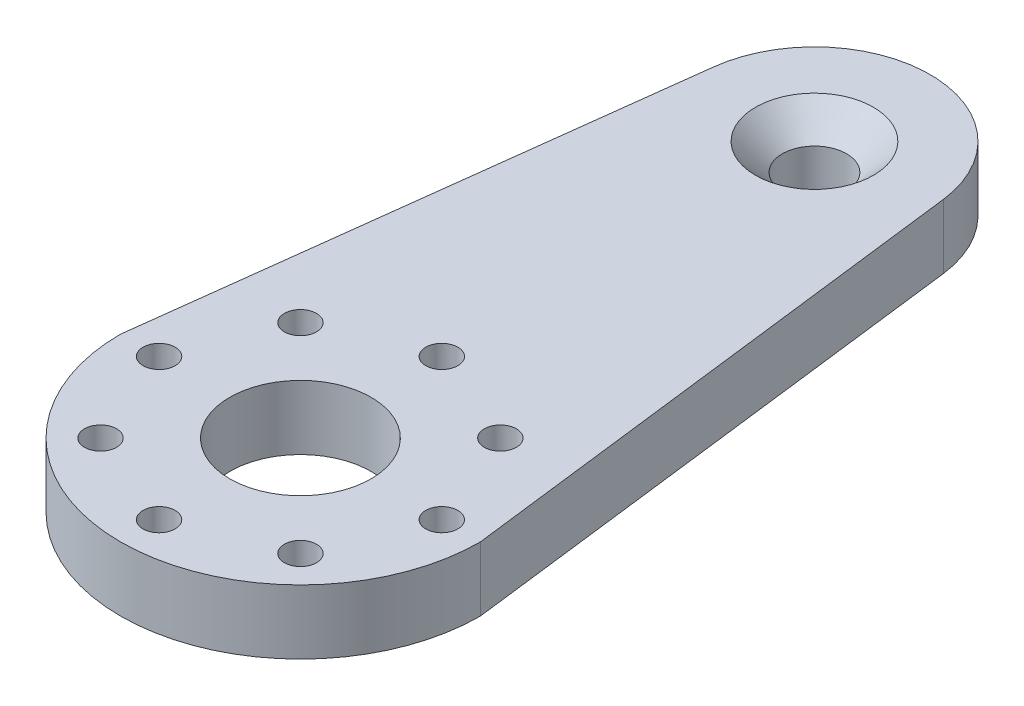
from build123d import *

# Parameters (mm, degrees)
SKETCH1_R                                            = 2.5
SKETCH1_R_2                                          = 5.5
BOSS_EXTRUDE1_DEPTH                                  = 5
SKETCH2_R                                            = 1.25
CUT_EXTRUDE1_DEPTH                                   = 57.00892786
CUT_EXTRUDE2_DEPTH                                   = 57.00892786
CSK_FOR_M4_HEX_SOCKET_COUNTERSUNK_HEAD_S_D           = 4.5
CSK_FOR_M4_HEX_SOCKET_COUNTERSUNK_HEAD_S_CSINK_D     = 9.18
CSK_FOR_M4_HEX_SOCKET_COUNTERSUNK_HEAD_S_CSINK_ANGLE = 90


with BuildPart() as part:
    # Sketch1 → Boss-Extrude1 (new body)
    with BuildSketch(Plane(origin=(0, 0, 0), x_dir=(1, 0, 0), z_dir=(0, 1, 0))):
        with BuildLine():
            Line((-14, 0), (-14, 40))
            ThreePointArc((-14, 40), (0, 54), (14, 40))
            Line((14, 40), (14, 0))
            ThreePointArc((14, 0), (0, -14), (-14, 0))
        make_face()
        with Locations(Location((0, 40, 0), (0, 0, 270))):
            Circle(SKETCH1_R, mode=Mode.SUBTRACT)
        with Locations(Location((0, 0, 0), (0, 0, 270))):
            Circle(SKETCH1_R_2, mode=Mode.SUBTRACT)
    extrude(amount=BOSS_EXTRUDE1_DEPTH)

    # Sketch2 → Cut-Extrude1 (cut, through all)
    with BuildSketch(Plane(origin=(0, 5, 0), x_dir=(1, 0, 0), z_dir=(0, 1, 0))):
        with Locations(Location((0, 11, 0), (0, 0, 270))):
            Circle(SKETCH2_R)
        with Locations(Location((7.778174593, 7.778174593, 0), (0, 0, 270))):
            Circle(SKETCH2_R)
        with Locations(Location((11, 0, 0), (0, 0, 270))):
            Circle(SKETCH2_R)
        with Locations(Location((7.778174593, -7.778174593, 0), (0, 0, 270))):
            Circle(SKETCH2_R)
        with Locations(Location((0, -11, 0), (0, 0, 270))):
            Circle(SKETCH2_R)
        with Locations(Location((-7.778174593, -7.778174593, 0), (0, 0, 270))):
            Circle(SKETCH2_R)
        with Locations(Location((-11, 0, 0), (0, 0, 270))):
            Circle(SKETCH2_R)
        with Locations(Location((-7.778174593, 7.778174593, 0), (0, 0, 270))):
            Circle(SKETCH2_R)
    extrude(amount=-CUT_EXTRUDE1_DEPTH, mode=Mode.SUBTRACT)

    # Sketch3 → Cut-Extrude2 (cut, through all)
    with BuildSketch(Plane(origin=(0, 5, 0), x_dir=(1, 0, 0), z_dir=(0, 1, 0))):
        with BuildLine():
            Line((-14, 40), (-14, 0))
            Line((-14, 0), (-8.932361388, 41.101326486))
            ThreePointArc((-8.932361388, 41.101326486), (0, 49), (8.932361388, 41.101326486))
            Line((8.932361388, 41.101326486), (14, 0))
            Line((14, 0), (14, 40))
            ThreePointArc((14, 40), (0, 54), (-14, 40))
        make_face()
    extrude(amount=-CUT_EXTRUDE2_DEPTH, mode=Mode.SUBTRACT)

    # CSK for M4 Hex Socket Countersunk Head Screw2 (through all)
    with Locations(Plane(origin=(0, 5, 0), x_dir=(1, 0, 0), z_dir=(0, 1, 0))):
        with Locations((0, 40)):
            CounterSinkHole(CSK_FOR_M4_HEX_SOCKET_COUNTERSUNK_HEAD_S_D / 2, CSK_FOR_M4_HEX_SOCKET_COUNTERSUNK_HEAD_S_CSINK_D / 2, counter_sink_angle=CSK_FOR_M4_HEX_SOCKET_COUNTERSUNK_HEAD_S_CSINK_ANGLE)


solid = part.part
